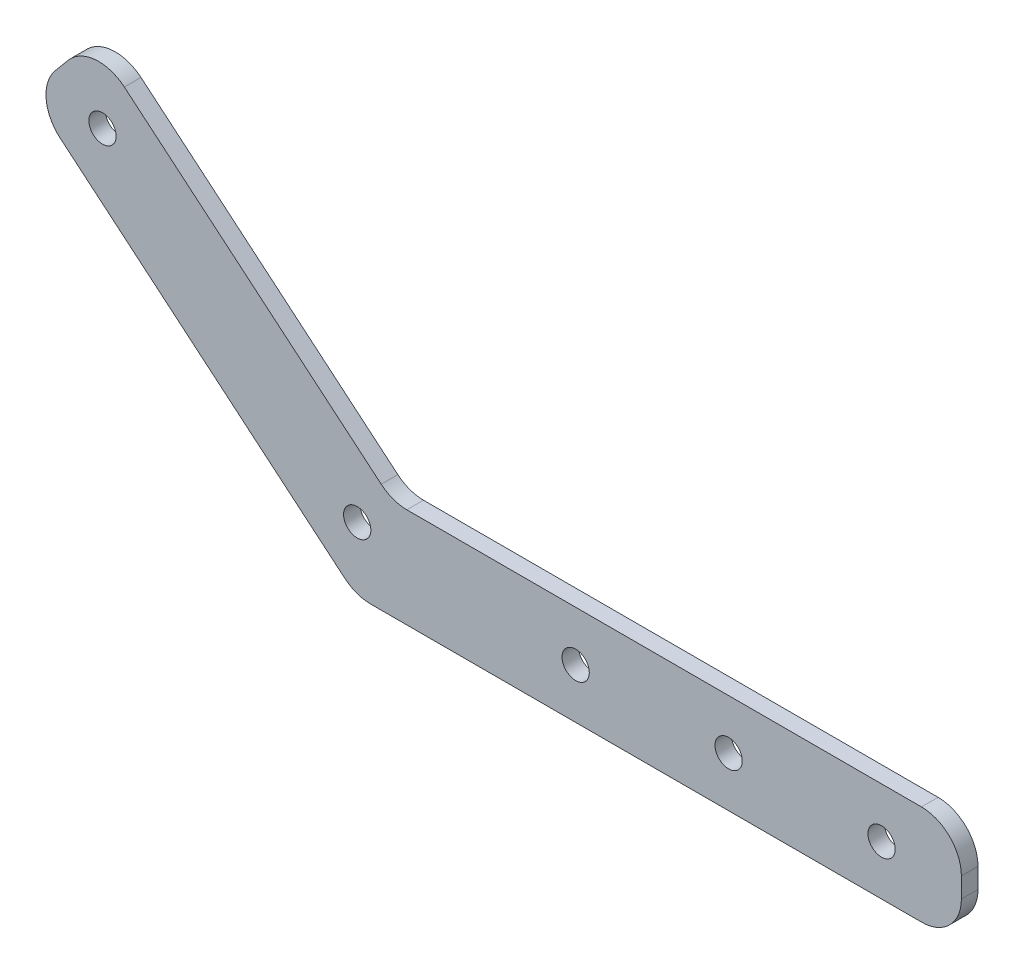
from build123d import *

# Parameters (mm, degrees)
SKETCH2_R           = 2.6035
BOSS_EXTRUDE1_DEPTH = 3.175
FILLET1_R           = 7.62


with BuildPart() as part:
    # Sketch2 → Boss-Extrude1 (new body)
    with BuildSketch(Plane.XY):
        Polygon((0, -9.525), (0, 9.525), (-108.669578778, 9.525), (-165.682370629, 57.364412615), (-177.927474593, 42.771265973), (-115.60321174, -9.525), align=None)
        with Locations((-164.021911069, 43.53711718)):
            Circle(SKETCH2_R, mode=Mode.SUBTRACT)
        with Locations((-115.378088931, 2.720103965)):
            Circle(SKETCH2_R, mode=Mode.SUBTRACT)
        with Locations((-73.66, 0)):
            Circle(SKETCH2_R, mode=Mode.SUBTRACT)
        with Locations((-44.45, 0)):
            Circle(SKETCH2_R, mode=Mode.SUBTRACT)
        with Locations((-15.24, 0)):
            Circle(SKETCH2_R, mode=Mode.SUBTRACT)
    extrude(amount=BOSS_EXTRUDE1_DEPTH)

    # Fillet1
    fillet1_edges = [part.edges().sort_by_distance(p)[0] for p in [
        (-177.927474593, 42.771265973, 1.5875),
        (-115.60321174, -9.525, 1.5875),
        (0, -9.525, 1.5875),
        (0, 9.525, 1.5875),
        (-108.669578778, 9.525, 1.5875),
        (-165.682370629, 57.364412615, 1.5875),
    ]]
    fillet(fillet1_edges, radius=FILLET1_R)


solid = part.part
